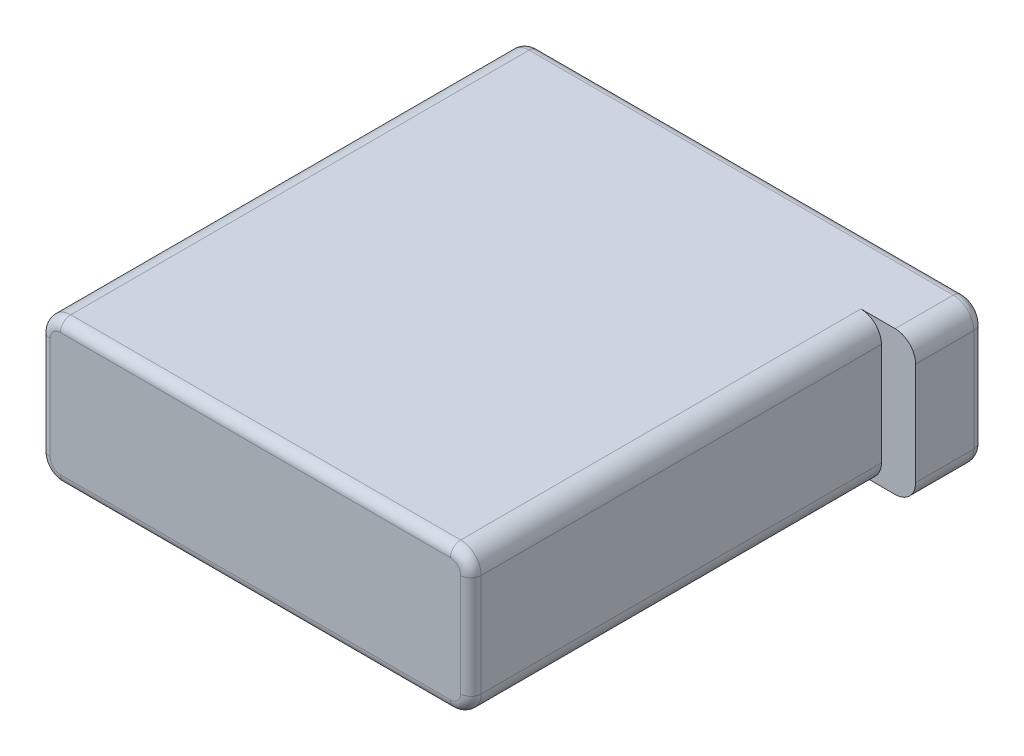
from build123d import *

# Parameters (mm, degrees)
SKETCH1_W           = 63
SKETCH1_H           = 70
BOSS_EXTRUDE1_DEPTH = 21
SKETCH2_W           = 10
SKETCH2_H           = 21
BOSS_EXTRUDE2_DEPTH = 5
FILLET3_R           = 3
FILLET4_R           = 1.5


with BuildPart() as part:
    # Sketch1 → Boss-Extrude1 (new body)
    with BuildSketch(Plane(origin=(0, 0, 0), x_dir=(1, 0, 0), z_dir=(0, 1, 0))):
        Rectangle(SKETCH1_W, SKETCH1_H)
    extrude(amount=BOSS_EXTRUDE1_DEPTH)

    # Sketch2 → Boss-Extrude2 (add)
    with BuildSketch(Plane(origin=(31.5, 0, 0), x_dir=(0, 0, -1), z_dir=(1, 0, 0))):
        with Locations((30, 10.5)):
            Rectangle(SKETCH2_W, SKETCH2_H)
    extrude(amount=BOSS_EXTRUDE2_DEPTH)

    # Fillet3
    fillet3_edges = [part.edges().sort_by_distance(p)[0] for p in [
        (31.5, 0, 5),
        (31.5, 21, 5),
        (36.5, 21, -30),
        (36.5, 0, -30),
        (-31.5, 21, 0),
        (-31.5, 0, 0),
    ]]
    fillet(fillet3_edges, radius=FILLET3_R)

    # Fillet4
    fillet4_edges = [part.edges().sort_by_distance(p)[0] for p in [
        (-31.5, 10.5, 35),
        (-31.5, 10.5, -35),
        (0, 0, 35),
        (31.5, 10.5, 35),
        (0, 21, 35),
        (30.621320344, 20.121320344, 35),
        (30.621320344, 0.878679656, 35),
        (-30.621320344, 20.121320344, 35),
        (-30.621320344, 0.878679656, 35),
        (2.5, 0, -35),
        (2.5, 21, -35),
        (36.5, 10.5, -35),
        (35.621320344, 20.121320344, -35),
        (35.621320344, 0.878679656, -35),
        (-30.621320344, 20.121320344, -35),
        (-30.621320344, 0.878679656, -35),
    ]]
    fillet(fillet4_edges, radius=FILLET4_R)


solid = part.part
